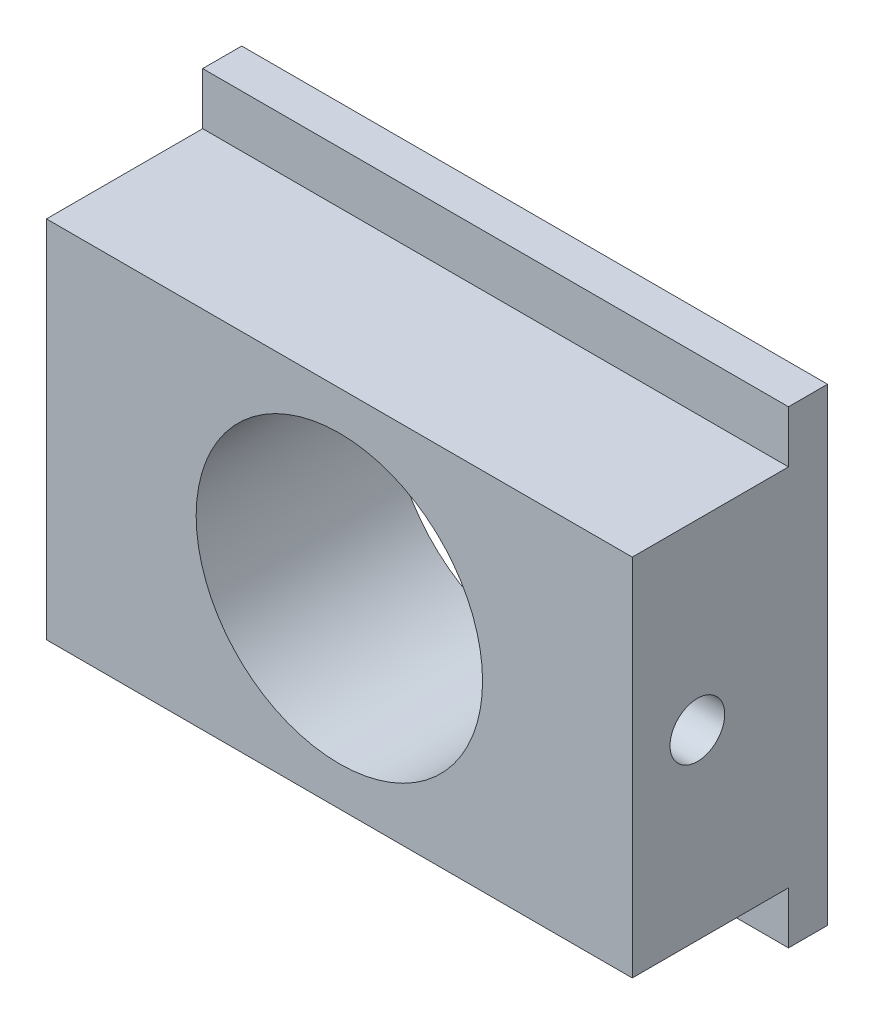
from build123d import *

# Parameters (mm, degrees)
SKETCH1_W                 = 45
SKETCH1_H                 = 28
SKETCH1_R                 = 11
BOSS_EXTRUDE1_DEPTH       = 20
M5X0_8_TAPPED_HOLE1_D     = 4.2
M5X0_8_TAPPED_HOLE1_DEPTH = 8
M5X0_8_TAPPED_HOLE1_TIP   = 1.2618073
SKETCH6_W                 = 45
SKETCH6_H                 = 28
CUT_EXTRUDE1_DEPTH        = 5
SKETCH7_W                 = 45
SKETCH7_H                 = 4
BOSS_EXTRUDE5_DEPTH       = 3


with BuildPart() as part:
    # Sketch1 → Boss-Extrude1 (new body)
    with BuildSketch(Plane.XY):
        with Locations((22.5, 14)):
            Rectangle(SKETCH1_W, SKETCH1_H)
        with Locations((22.5, 14)):
            Circle(SKETCH1_R, mode=Mode.SUBTRACT)
    extrude(amount=BOSS_EXTRUDE1_DEPTH)

    # M5x0.8 Tapped Hole1
    with Locations(Plane(origin=(45, 14, 15), x_dir=(0, 0, 1), z_dir=(1, 0, 0))):
        with Locations((0, 0)):
            Hole(M5X0_8_TAPPED_HOLE1_D / 2, depth=M5X0_8_TAPPED_HOLE1_DEPTH)
            with Locations((0, 0, -(M5X0_8_TAPPED_HOLE1_DEPTH + M5X0_8_TAPPED_HOLE1_TIP / 2))):  # 118° drill point
                Cone(0, M5X0_8_TAPPED_HOLE1_D / 2, M5X0_8_TAPPED_HOLE1_TIP, mode=Mode.SUBTRACT)

    # Sketch6 → Cut-Extrude1 (cut)
    with BuildSketch(Plane(origin=(0, 0, 0), x_dir=(-1, 0, 0), z_dir=(0, 0, -1))):
        with Locations((-22.5, 14)):
            Rectangle(SKETCH6_W, SKETCH6_H)
    extrude(amount=-CUT_EXTRUDE1_DEPTH, mode=Mode.SUBTRACT)

    # Sketch7 → Boss-Extrude5 (add)
    with BuildSketch(Plane(origin=(0, 0, 5), x_dir=(-1, 0, 0), z_dir=(0, 0, -1))):
        with Locations((-22.5, 30)):
            Rectangle(SKETCH7_W, SKETCH7_H)
        with Locations((-22.5, -2)):
            Rectangle(SKETCH7_W, SKETCH7_H)
    extrude(amount=-BOSS_EXTRUDE5_DEPTH)


solid = part.part
